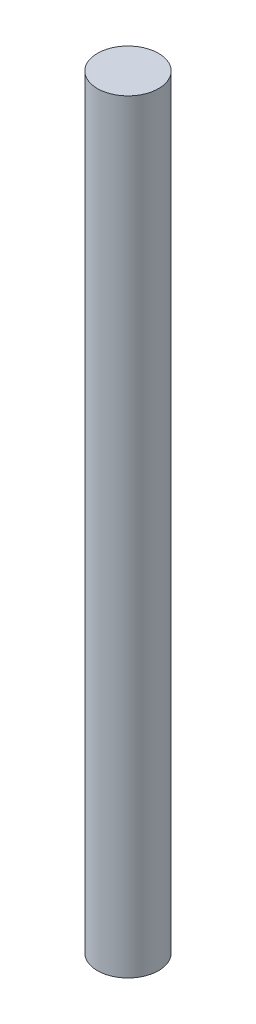
from build123d import *

# Parameters (mm, degrees)
SKETCH1_R           = 6
BOSS_EXTRUDE1_DEPTH = 150


with BuildPart() as part:
    # Sketch1 → Boss-Extrude1 (new body)
    with BuildSketch(Plane(origin=(0, 0, 0), x_dir=(1, 0, 0), z_dir=(0, 1, 0))):
        with Locations(Location((0, 0, 0), (0, 0, 270))):
            Circle(SKETCH1_R)
    extrude(amount=BOSS_EXTRUDE1_DEPTH)


solid = part.part
